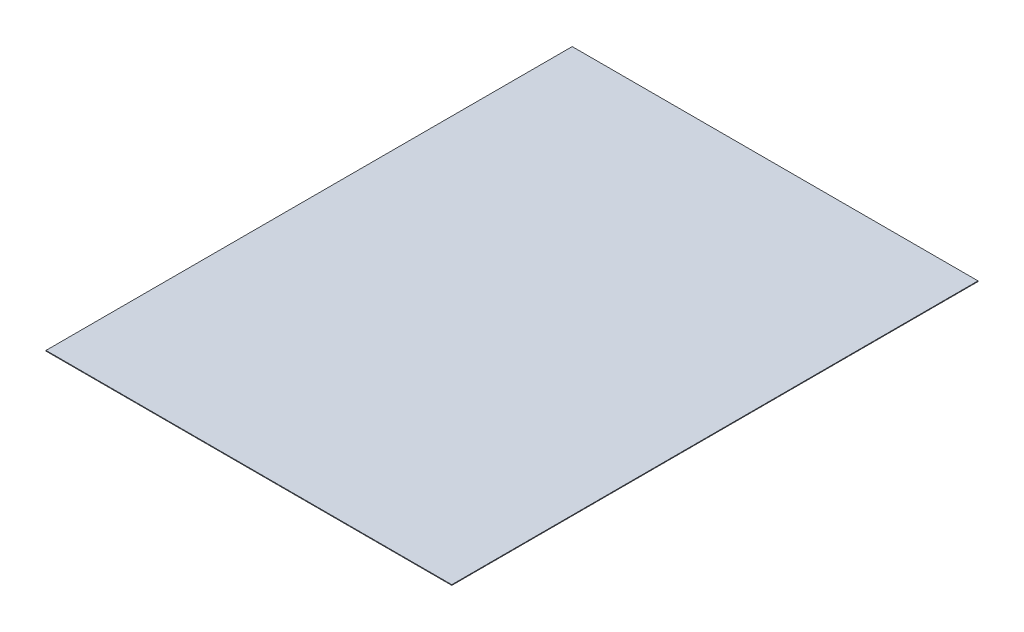
from build123d import *

# Parameters (mm, degrees)
SKETCH1_W              = 615
SKETCH1_H              = 1
TOPPING_IC_ALT_1_DEPTH = 797.5


with BuildPart() as part:
    # Sketch1 → TOPPING_ic_alt_1 (new body)
    with BuildSketch(Plane.XY):
        with Locations((350, 242)):
            Rectangle(SKETCH1_W, SKETCH1_H)
    extrude(amount=-TOPPING_IC_ALT_1_DEPTH)


solid = part.part
